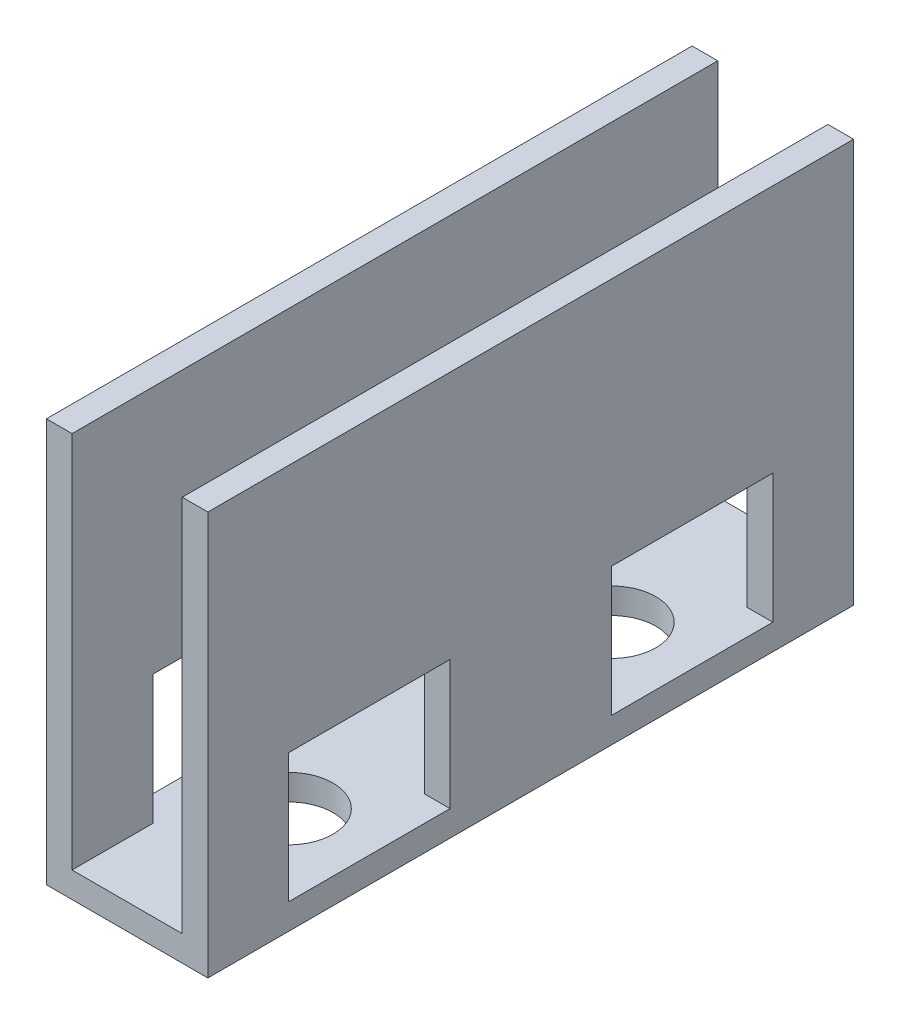
from build123d import *

# Parameters (mm, degrees)
SKETCH1_W           = 1.5875
SKETCH1_H           = 40
SKETCH1_W_2         = 6.825
BOSS_EXTRUDE1_DEPTH = 1.5875
SKETCH1_3_W         = 1.5875
SKETCH1_3_H         = 40
BOSS_EXTRUDE2_DEPTH = 25
SKETCH2_W           = 10
SKETCH2_H           = 8
CUT_EXTRUDE1_DEPTH  = 34.541019662


with BuildPart() as part:
    # Sketch1 → Boss-Extrude1 (new body)
    # profile 1 of 9: a face of its own
    with BuildSketch(Plane(origin=(0, 0, 0), x_dir=(1, 0, 0), z_dir=(0, 1, 0))):
        with Locations((-4.20625, 0)):
            Rectangle(SKETCH1_W, SKETCH1_H)
    # profile 2 of 9: a face of its own
    with BuildSketch(Plane(origin=(0, 0, 0), x_dir=(1, 0, 0), z_dir=(0, 1, 0))):
        Rectangle(SKETCH1_W_2, SKETCH1_H)
        with BuildLine():
            ThreePointArc((2.75, -10), (-1.944543648, -11.944543648), (0, -7.25))
            ThreePointArc((0, -7.25), (1.944543648, -8.055456352), (2.75, -10))
        make_face(mode=Mode.SUBTRACT)
        with BuildLine():
            ThreePointArc((2.75, 10), (1.944543648, 8.055456352), (0, 7.25))
            ThreePointArc((0, 7.25), (-1.944543648, 11.944543648), (2.75, 10))
        make_face(mode=Mode.SUBTRACT)
    # profile 3 of 9: a face of its own
    with BuildSketch(Plane(origin=(0, 0, 0), x_dir=(1, 0, 0), z_dir=(0, 1, 0))):
        with Locations((4.20625, 0)):
            Rectangle(SKETCH1_W, SKETCH1_H)
    # profile 4 of 9: a face of its own
    with BuildSketch(Plane(origin=(0, 0, 0), x_dir=(1, 0, 0), z_dir=(0, 1, 0))):
        with Locations((4.20625, 0)):
            Rectangle(SKETCH1_W, SKETCH1_H)
    # profile 5 of 9: a face of its own
    with BuildSketch(Plane(origin=(0, 0, 0), x_dir=(1, 0, 0), z_dir=(0, 1, 0))):
        Rectangle(SKETCH1_W_2, SKETCH1_H)
        with BuildLine():
            ThreePointArc((2.75, -10), (-1.944543648, -11.944543648), (0, -7.25))
            ThreePointArc((0, -7.25), (1.944543648, -8.055456352), (2.75, -10))
        make_face(mode=Mode.SUBTRACT)
        with BuildLine():
            ThreePointArc((2.75, 10), (1.944543648, 8.055456352), (0, 7.25))
            ThreePointArc((0, 7.25), (-1.944543648, 11.944543648), (2.75, 10))
        make_face(mode=Mode.SUBTRACT)
    # profile 6 of 9: a face of its own
    with BuildSketch(Plane(origin=(0, 0, 0), x_dir=(1, 0, 0), z_dir=(0, 1, 0))):
        with Locations((-4.20625, 0)):
            Rectangle(SKETCH1_W, SKETCH1_H)
    # profile 7 of 9: a face of its own
    with BuildSketch(Plane(origin=(0, 0, 0), x_dir=(1, 0, 0), z_dir=(0, 1, 0))):
        with Locations((-4.20625, 0)):
            Rectangle(SKETCH1_W, SKETCH1_H)
    # profile 8 of 9: a face of its own
    with BuildSketch(Plane(origin=(0, 0, 0), x_dir=(1, 0, 0), z_dir=(0, 1, 0))):
        Rectangle(SKETCH1_W_2, SKETCH1_H)
        with BuildLine():
            ThreePointArc((2.75, -10), (-1.944543648, -11.944543648), (0, -7.25))
            ThreePointArc((0, -7.25), (1.944543648, -8.055456352), (2.75, -10))
        make_face(mode=Mode.SUBTRACT)
        with BuildLine():
            ThreePointArc((2.75, 10), (1.944543648, 8.055456352), (0, 7.25))
            ThreePointArc((0, 7.25), (-1.944543648, 11.944543648), (2.75, 10))
        make_face(mode=Mode.SUBTRACT)
    # profile 9 of 9: a face of its own
    with BuildSketch(Plane(origin=(0, 0, 0), x_dir=(1, 0, 0), z_dir=(0, 1, 0))):
        with Locations((4.20625, 0)):
            Rectangle(SKETCH1_W, SKETCH1_H)
    extrude(amount=BOSS_EXTRUDE1_DEPTH)

    # Sketch1<3> → Boss-Extrude2 (add)
    with BuildSketch(Plane(origin=(0, 0, 0), x_dir=(1, 0, 0), z_dir=(0, 1, 0))):
        with Locations((-4.20625, 0)):
            Rectangle(SKETCH1_3_W, SKETCH1_3_H)
        with Locations((4.20625, 0)):
            Rectangle(SKETCH1_3_W, SKETCH1_3_H)
    extrude(amount=BOSS_EXTRUDE2_DEPTH)

    # Sketch2 → Cut-Extrude1 (cut, through all)
    with BuildSketch(Plane(origin=(5, 0, 0), x_dir=(0, 0, -1), z_dir=(1, 0, 0))):
        with Locations((-10, 5.5875)):
            Rectangle(SKETCH2_W, SKETCH2_H)
        with Locations((10, 5.5875)):
            Rectangle(SKETCH2_W, SKETCH2_H)
    extrude(amount=-CUT_EXTRUDE1_DEPTH, mode=Mode.SUBTRACT)


solid = part.part
